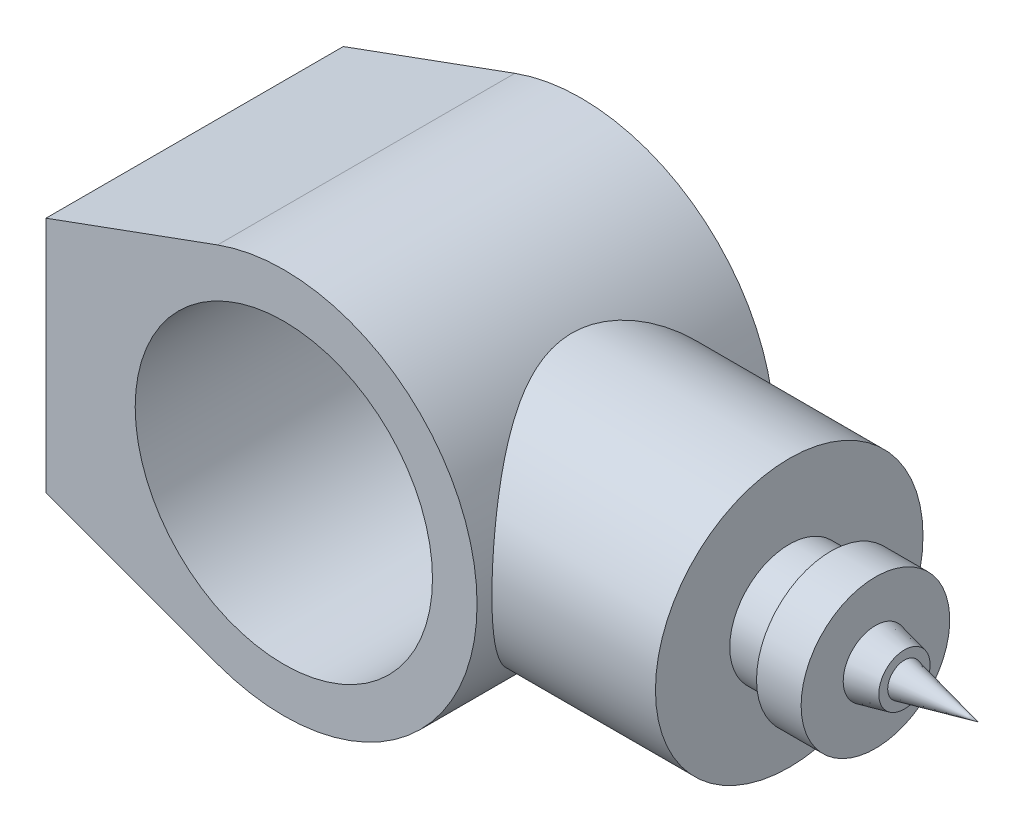
from build123d import *

# Parameters (mm, degrees)
SKETCH1_R                = 50
BOSS_EXTRUDE1_DEPTH      = 50
BOSS_EXTRUDE2_REACH      = 218.16
BOSS_EXTRUDE2_END_RADIUS = 65
SKETCH2_R                = 45


with BuildPart() as part:
    # Sketch1 → Boss-Extrude1 (new, symmetric)
    with BuildSketch(Plane.XY):
        with BuildLine():
            Line((-80, 40), (-80, -40))
            Line((-80, -40), (-22.281665693, -61.061668614))
            ThreePointArc((-22.281665693, -61.061668614), (65, 0), (-22.281665693, 61.061668614))
            Line((-22.281665693, 61.061668614), (-80, 40))
        make_face()
        Circle(SKETCH1_R, mode=Mode.SUBTRACT)
    extrude(amount=BOSS_EXTRUDE1_DEPTH, both=True)

    # Boss-Extrude2: up to this cylinder (the profile starts outside it)
    boss_extrude2_end = Plane(origin=(0, 0, 0), z_dir=(0, 0, -1)) * Cylinder(BOSS_EXTRUDE2_END_RADIUS, 567.32, mode=Mode.PRIVATE)
    # Sketch2 → Boss-Extrude2 (add, up to the surface)
    with BuildSketch(Plane(origin=(120, 0, 0), x_dir=(0, 0, -1), z_dir=(1, 0, 0)), mode=Mode.PRIVATE) as boss_extrude2_sk1:
        Circle(SKETCH2_R)
    boss_extrude2_tool1 = extrude(boss_extrude2_sk1.sketch, amount=-BOSS_EXTRUDE2_REACH, mode=Mode.PRIVATE) - boss_extrude2_end
    add(boss_extrude2_tool1.solids().sort_by_distance((120, 0, 0))[0])

    # Sketch4 → Revolve1 (revolve)
    with BuildSketch(Plane.XY, mode=Mode.PRIVATE) as revolve1_sk:
        Polygon((120, 0), (120, -20), (134, -20), (134, -25), (149, -25), (149, -10.84553833), (158.751026924, -8.628000521), (158.751026924, -5.628000521), (183.498647636, 0), align=None)
    revolve(revolve1_sk.sketch.rotate(Axis((0, 0, 0), (1, 0, 0)), 270), axis=Axis((0, 0, 0), (1, 0, 0)))


solid = part.part
